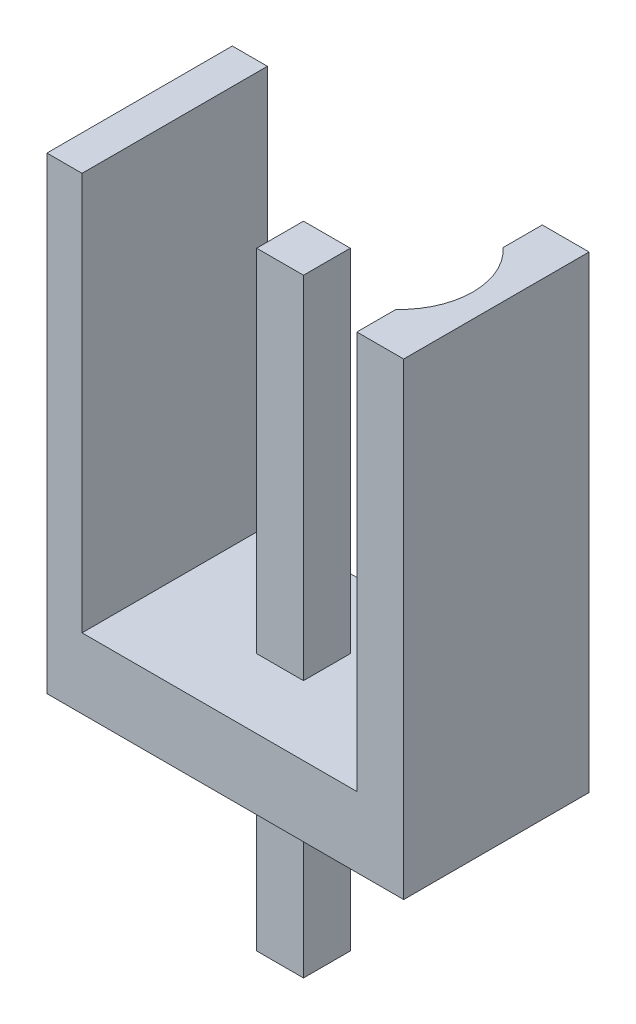
from build123d import *

# Parameters (mm, degrees)
SKETCH_1_W           = 7.62
SKETCH_1_H           = 3.96
EXTRUDE_1_DEPTH      = 10
CUT_EXTRUDE_1_DEPTH  = 8.5
EXTRUDE_2_DEPTH      = 4
EXTRUDE_2_DEPTH_BACK = 9
SKETCH_3_W           = 1
SKETCH_3_H           = 1


with BuildPart() as part:
    # 草图1 → 拉伸1 (new body)
    with BuildSketch(Plane(origin=(0, 0, 0), x_dir=(1, 0, 0), z_dir=(0, 1, 0))):
        Rectangle(SKETCH_1_W, SKETCH_1_H)
    extrude(amount=EXTRUDE_1_DEPTH)

    # 草图2 → 切除-拉伸1 (cut)
    with BuildSketch(Plane(origin=(0, 10, 0), x_dir=(-1, 0, 0), z_dir=(0, 1, 0))):
        with BuildLine():
            Line((-2.81, 1.144818304), (-2.81, 1.98))
            Line((-2.81, 1.98), (3.06, 1.98))
            Line((3.06, 1.98), (3.06, -1.98))
            Line((3.06, -1.98), (-2.81, -1.98))
            Line((-2.81, -1.98), (-2.81, -1.144818304))
            ThreePointArc((-2.81, -1.144818304), (-3.31, 0), (-2.81, 1.144818304))
        make_face()
    extrude(amount=-CUT_EXTRUDE_1_DEPTH, mode=Mode.SUBTRACT)

    # 草图3 → 拉伸2 (add, two sides: drawn at the far end of the back side and taken through both)
    with BuildSketch(Plane.XZ.offset(-EXTRUDE_2_DEPTH_BACK)):
        with Locations((-0.31, 0)):
            Rectangle(SKETCH_3_W, SKETCH_3_H)
    extrude(amount=EXTRUDE_2_DEPTH + EXTRUDE_2_DEPTH_BACK)


solid = part.part
